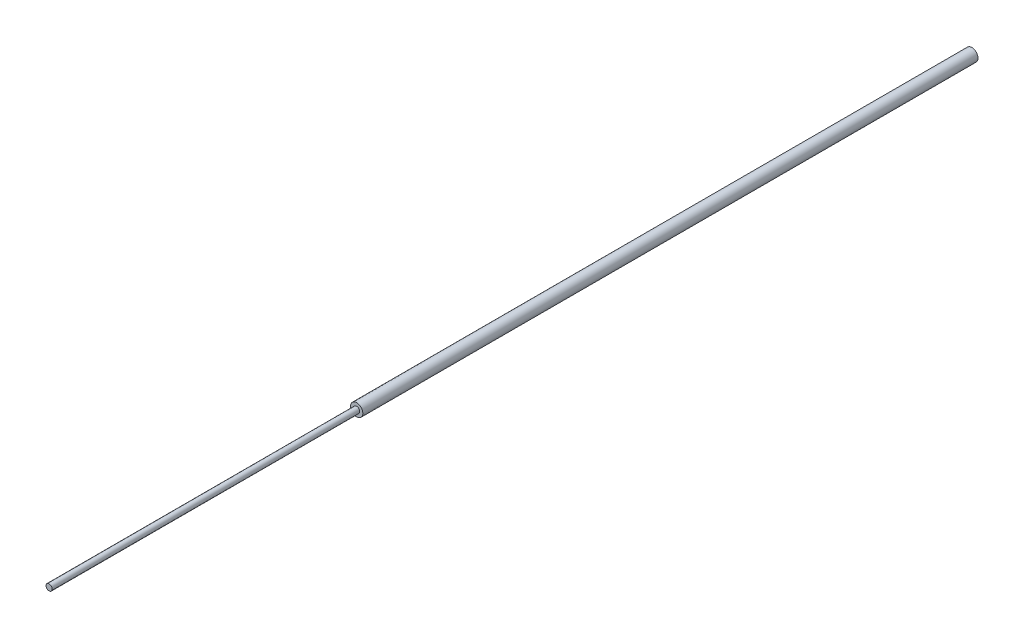
from build123d import *

# Parameters (mm, degrees)
ESQUISSE1_R        = 3
BOSS_EXTRU_1_DEPTH = 300
ESQUISSE2_R        = 1.5
BOSS_EXTRU_2_DEPTH = 150


with BuildPart() as part:
    # Esquisse1 → Boss.-Extru.1 (new body)
    with BuildSketch(Plane.XY):
        Circle(ESQUISSE1_R)
    extrude(amount=BOSS_EXTRU_1_DEPTH)

    # Esquisse2 → Boss.-Extru.2 (add)
    with BuildSketch(Plane.XY.offset(300)):
        Circle(ESQUISSE2_R)
    extrude(amount=BOSS_EXTRU_2_DEPTH)


solid = part.part
